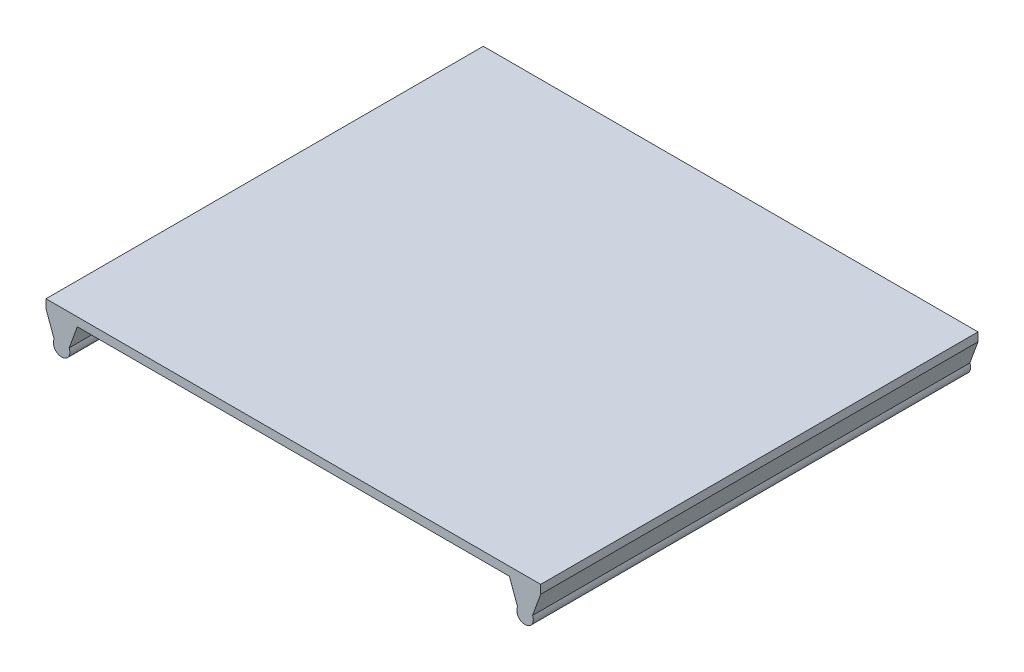
from build123d import *

# Parameters (mm, degrees)
BOSS_EXTRUDE1_DEPTH = 254


with BuildPart() as part:
    # Sketch1 → Boss-Extrude1 (new body)
    with BuildSketch(Plane.XY):
        with BuildLine():
            Line((-9.095097891, 15), (-4.363484846, 2))
            ThreePointArc((-4.363484846, 2), (0, -4.8), (4.363484846, 2))
            Line((4.363484846, 2), (9.095097891, 15))
            Line((9.095097891, 15), (260.044118109, 15))
            Line((260.044118109, 15), (264.775731154, 2))
            ThreePointArc((264.775731154, 2), (269.139216, -4.8), (273.502700846, 2))
            Line((273.502700846, 2), (278.234313891, 15))
            Line((278.234313891, 15), (278.234313891, 20))
            Line((278.234313891, 20), (-9.095097891, 20))
            Line((-9.095097891, 20), (-9.095097891, 15))
        make_face()
    extrude(amount=BOSS_EXTRUDE1_DEPTH)


solid = part.part
